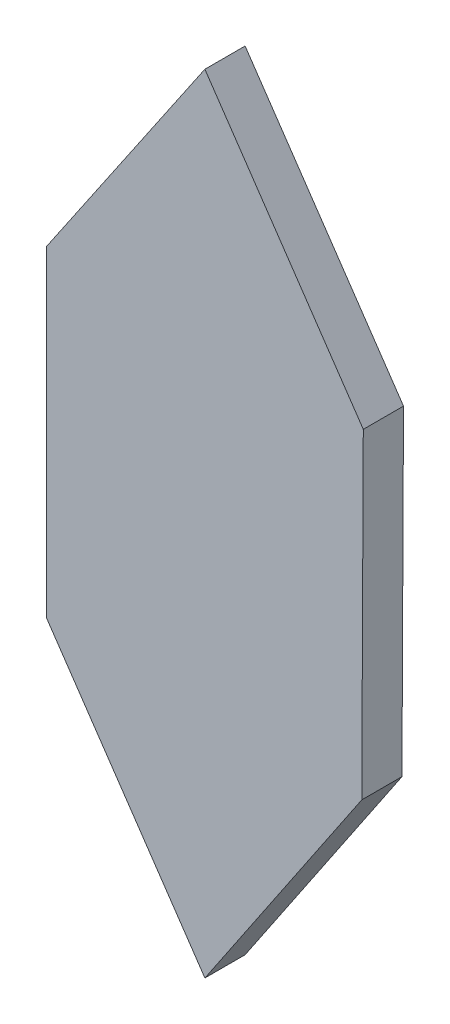
from build123d import *

# Parameters (mm, degrees)
BOSS_EXTRUDE3_DEPTH = 5


with BuildPart() as part:
    # Sketch1 → Boss-Extrude3 (new body)
    with BuildSketch(Plane.XY):
        Polygon((-39.200125475, 40), (-39.200125475, 0), (-19.504848319, -28.932612356), (0, 0), (0.190428836, 40), (-19.504848319, 68.932612356), align=None)
    extrude(amount=BOSS_EXTRUDE3_DEPTH)


solid = part.part
